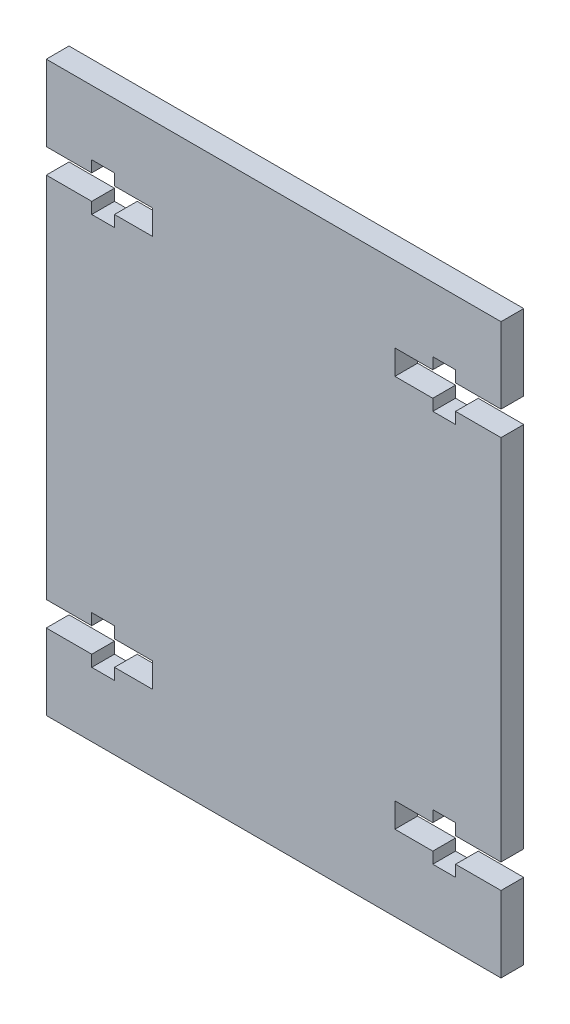
from build123d import *

# Parameters (mm, degrees)
BOSS_EXTRU_1_DEPTH = 3


with BuildPart() as part:
    # Esquisse1 → Boss.-Extru.1 (new body)
    with BuildSketch(Plane.XY):
        Polygon((-30, 37.5), (30, 37.5), (30, 27.5), (24, 27.5), (24, 29), (21, 29), (21, 27.5), (16, 27.5), (16, 24.25), (21, 24.25), (21, 22.75), (24, 22.75), (24, 24.25), (30, 24.25), (30, 12.5), (30, -12.5), (30, -24.25), (24, -24.25), (24, -22.75), (21, -22.75), (21, -24.25), (16, -24.25), (16, -27.5), (21, -27.5), (21, -29), (24, -29), (24, -27.5), (30, -27.5), (30, -37.5), (-30, -37.5), (-30, -27.5), (-24, -27.5), (-24, -29), (-21, -29), (-21, -27.5), (-16, -27.5), (-16, -24.25), (-21, -24.25), (-21, -22.75), (-24, -22.75), (-24, -24.25), (-30, -24.25), (-30, -12.5), (-30, 12.5), (-30, 24.25), (-24, 24.25), (-24, 22.75), (-21, 22.75), (-21, 24.25), (-16, 24.25), (-16, 27.5), (-21, 27.5), (-21, 29), (-24, 29), (-24, 27.5), (-30, 27.5), align=None)
    extrude(amount=BOSS_EXTRU_1_DEPTH)


solid = part.part
